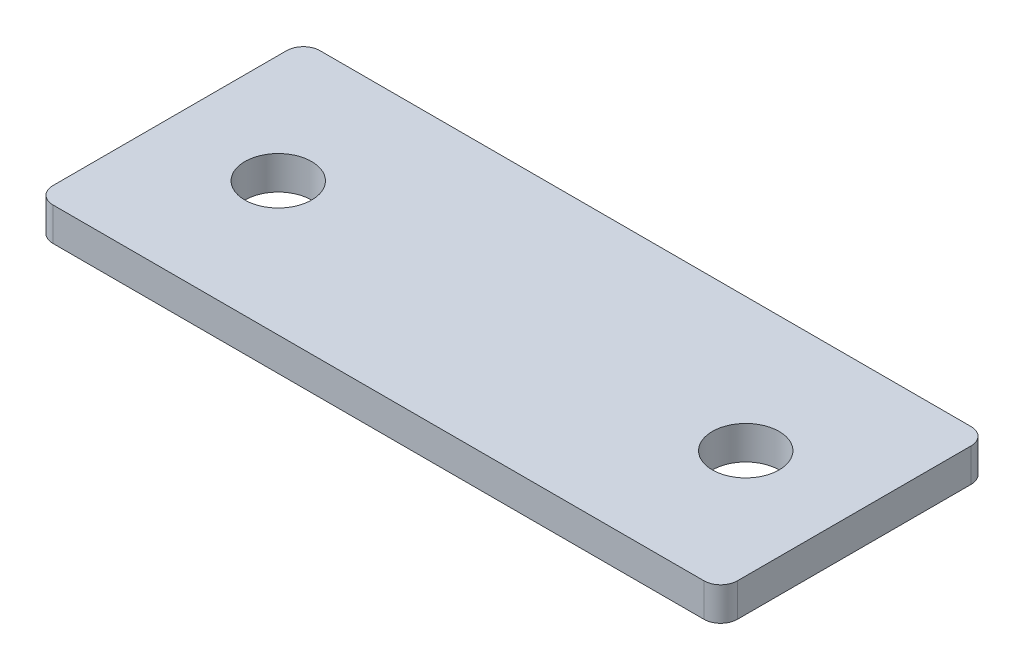
from build123d import *

# Parameters (mm, degrees)
SKETCH_1_W      = 41
SKETCH_1_H      = 16
SKETCH_1_R      = 2
EXTRUDE_1_DEPTH = 2
FILLET_1_R      = 1
FILLET_2_R      = 1
FILLET_3_R      = 1
FILLET_4_R      = 1


with BuildPart() as part:
    # 草图1 → 凸台-拉伸1 (new body)
    with BuildSketch(Plane(origin=(0, 0, 0), x_dir=(1, 0, 0), z_dir=(0, 1, 0))):
        Rectangle(SKETCH_1_W, SKETCH_1_H)
        with Locations(Location((-14, 0, 0), (0, 0, 270))):
            Circle(SKETCH_1_R, mode=Mode.SUBTRACT)
        with Locations(Location((14, 0, 0), (0, 0, 90))):
            Circle(SKETCH_1_R, mode=Mode.SUBTRACT)
    extrude(amount=EXTRUDE_1_DEPTH)

    # 圆角1
    fillet_1_edges = [part.edges().sort_by_distance(p)[0] for p in [
        (20.5, 1, 8),
    ]]
    fillet(fillet_1_edges, radius=FILLET_1_R)

    # 圆角2
    fillet_2_edges = [part.edges().sort_by_distance(p)[0] for p in [
        (-20.5, 1, 8),
    ]]
    fillet(fillet_2_edges, radius=FILLET_2_R)

    # 圆角3
    fillet_3_edges = [part.edges().sort_by_distance(p)[0] for p in [
        (-20.5, 1, -8),
    ]]
    fillet(fillet_3_edges, radius=FILLET_3_R)

    # 圆角4
    fillet_4_edges = [part.edges().sort_by_distance(p)[0] for p in [
        (20.5, 1, -8),
    ]]
    fillet(fillet_4_edges, radius=FILLET_4_R)


solid = part.part
